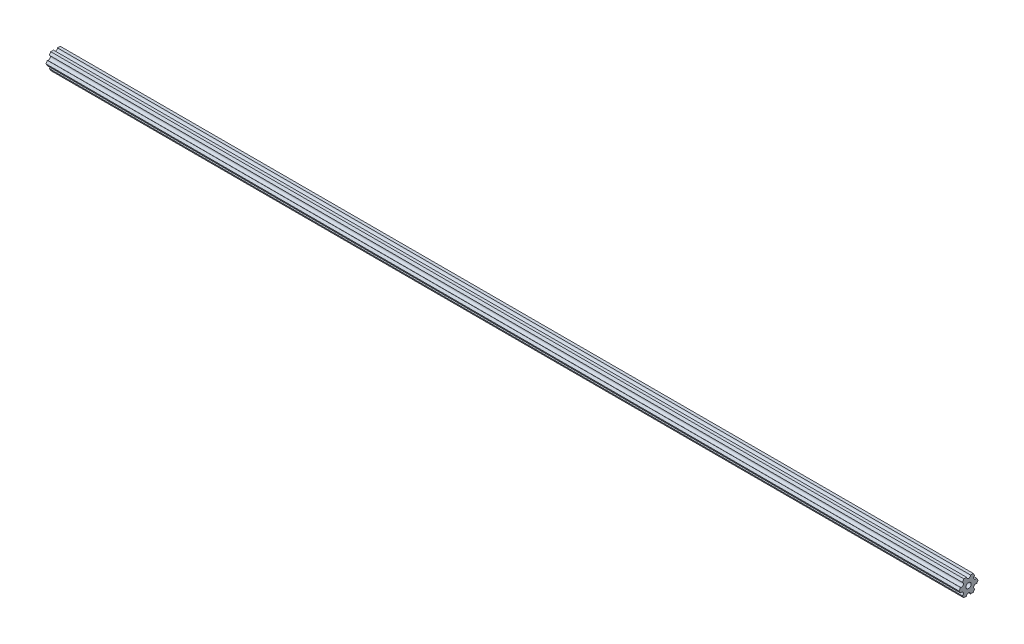
from build123d import *

# Parameters (mm, degrees)
SKETCH1_R           = 2.0193
BOSS_EXTRUDE1_DEPTH = 714.375
SKETCH2_R           = 1.524
CUT_EXTRUDE1_DEPTH  = 715.440848817
SKETCH3_R           = 21.255995951
CUT_EXTRUDE2_DEPTH  = 6.35


with BuildPart() as part:
    # Sketch1 → Boss-Extrude1 (new body)
    with BuildSketch(Plane(origin=(0, 0, 0), x_dir=(0, 0, -1), z_dir=(1, 0, 0))):
        Polygon((7.332348419, 0), (3.666174209, 6.35), (-3.666174209, 6.35), (-7.332348419, 0), (-3.666174209, -6.35), (3.666174209, -6.35), align=None)
        Circle(SKETCH1_R, mode=Mode.SUBTRACT)
    extrude(amount=BOSS_EXTRUDE1_DEPTH)

    # Sketch2 → Cut-Extrude1 (cut, through all)
    with BuildSketch(Plane(origin=(714.375, 0, 0), x_dir=(0, 0, -1), z_dir=(1, 0, 0))):
        with Locations((0, 6.35)):
            Circle(SKETCH2_R)
        with Locations((5.499261314, 3.175)):
            Circle(SKETCH2_R)
        with Locations((5.499261314, -3.175)):
            Circle(SKETCH2_R)
        with Locations((0, -6.35)):
            Circle(SKETCH2_R)
        with Locations((-5.499261314, -3.175)):
            Circle(SKETCH2_R)
        with Locations((-5.499261314, 3.175)):
            Circle(SKETCH2_R)
    extrude(amount=-CUT_EXTRUDE1_DEPTH, mode=Mode.SUBTRACT)

    # Sketch3 → Cut-Extrude2 (cut)
    with BuildSketch(Plane(origin=(714.375, 0, 0), x_dir=(0, 0, -1), z_dir=(1, 0, 0))):
        Circle(SKETCH3_R)
    extrude(amount=-CUT_EXTRUDE2_DEPTH, mode=Mode.SUBTRACT)


solid = part.part
